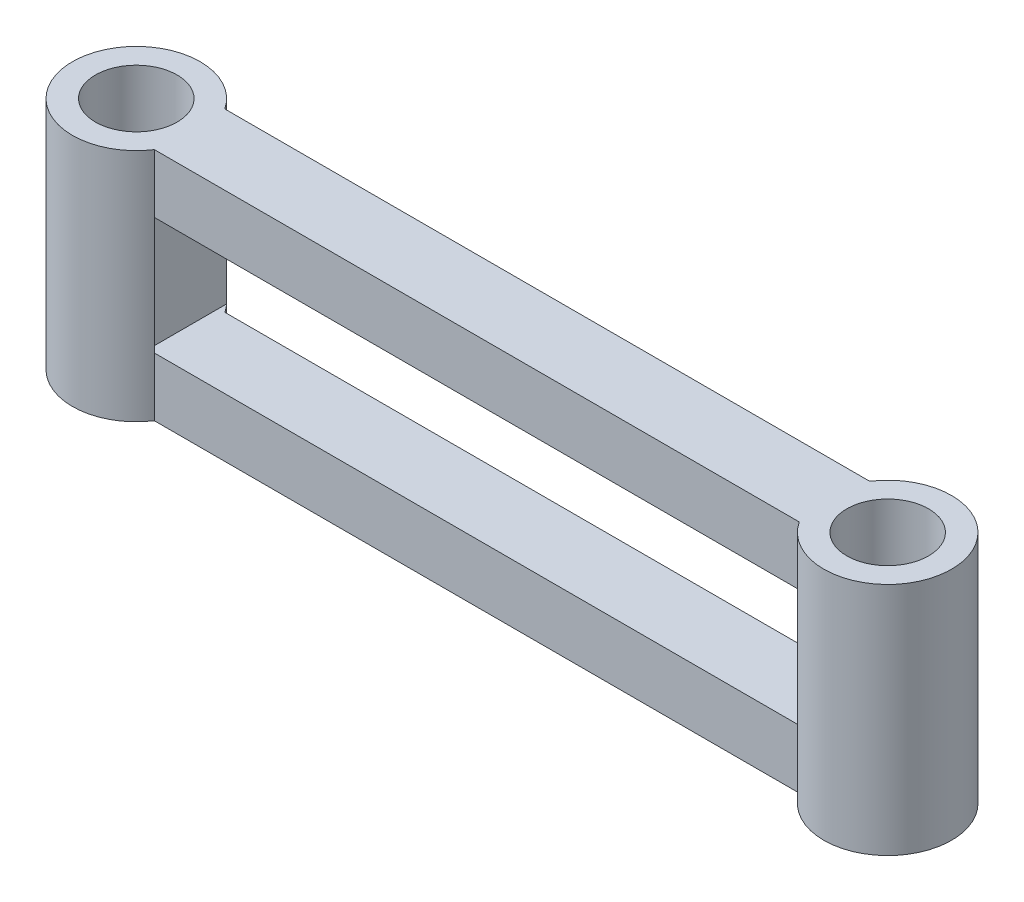
from build123d import *

# Parameters (mm, degrees)
SKETCH1_R           = 11.049
BOSS_EXTRUDE1_DEPTH = 63.5
SKETCH2_W           = 177.8
SKETCH2_H           = 31.75
CUT_EXTRUDE1_DEPTH  = 138.407720282


with BuildPart() as part:
    # Sketch1 → Boss-Extrude1 (new body)
    with BuildSketch(Plane(origin=(0, 0, 0), x_dir=(1, 0, 0), z_dir=(0, 1, 0))):
        with BuildLine():
            Line((-87.191795428, 59.02921057), (87.191795428, 59.02921057))
            ThreePointArc((87.191795428, 59.02921057), (118.872, 49.50421057), (87.191795428, 39.97921057))
            Line((87.191795428, 39.97921057), (-87.191795428, 39.97921057))
            ThreePointArc((-87.191795428, 39.97921057), (-118.872, 49.50421057), (-87.191795428, 59.02921057))
        make_face()
        with Locations(Location((101.6, 49.50421057, 0), (0, 0, 270))):
            Circle(SKETCH1_R, mode=Mode.SUBTRACT)
        with Locations(Location((-101.6, 49.50421057, 0), (0, 0, 270))):
            Circle(SKETCH1_R, mode=Mode.SUBTRACT)
    extrude(amount=BOSS_EXTRUDE1_DEPTH)

    # Sketch2 → Cut-Extrude1 (cut, through all)
    with BuildSketch(Plane.XY.offset(-39.97921057)):
        with Locations((0, 31.75)):
            Rectangle(SKETCH2_W, SKETCH2_H)
    extrude(amount=-CUT_EXTRUDE1_DEPTH, mode=Mode.SUBTRACT)


solid = part.part
